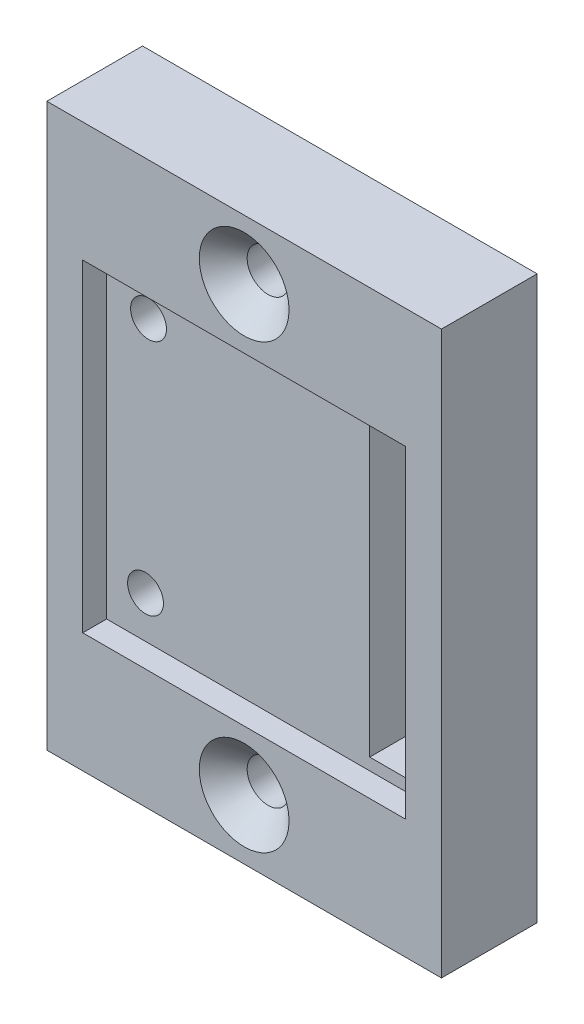
from build123d import *

# Parameters (mm, degrees)
SKETCH1_W           = 33
SKETCH1_H           = 47
SKETCH1_R           = 1.75
SKETCH1_W_2         = 27
SKETCH1_H_2         = 27
BOSS_EXTRUDE1_DEPTH = 8
SKETCH3_W           = 27
SKETCH3_H           = 27
BOSS_EXTRUDE2_DEPTH = 6
CHAMFER1_SIZE       = 2
SKETCH4_R           = 1.5
CUT_EXTRUDE1_DEPTH  = 10
SKETCH5_W           = 4
SKETCH5_H           = 25
CUT_EXTRUDE2_DEPTH  = 3
CUT_EXTRUDE3_DEPTH  = 3


with BuildPart() as part:
    # Sketch1 → Boss-Extrude1 (new body)
    with BuildSketch(Plane.XY):
        with Locations((16.5, 23.5)):
            Rectangle(SKETCH1_W, SKETCH1_H)
        with Locations((16.5, 42)):
            Circle(SKETCH1_R, mode=Mode.SUBTRACT)
        with Locations((16.5, 5)):
            Circle(SKETCH1_R, mode=Mode.SUBTRACT)
        with Locations((16.5, 23.5)):
            Rectangle(SKETCH1_W_2, SKETCH1_H_2, mode=Mode.SUBTRACT)
    extrude(amount=BOSS_EXTRUDE1_DEPTH)

    # Sketch3 → Boss-Extrude2 (add)
    with BuildSketch(Plane(origin=(0, 0, 0), x_dir=(-1, 0, 0), z_dir=(0, 0, -1))):
        with Locations((-16.5, 23.5)):
            Rectangle(SKETCH3_W, SKETCH3_H)
    extrude(amount=-BOSS_EXTRUDE2_DEPTH)

    # Chamfer1
    chamfer1_edges = [part.edges().sort_by_distance(p)[0] for p in [
        (14.75, 42, 8),
        (14.75, 5, 8),
    ]]
    chamfer(chamfer1_edges, length=CHAMFER1_SIZE)

    # Sketch4 → Cut-Extrude1 (cut)
    with BuildSketch(Plane.XY.offset(6)):
        with Locations((6.5, 33.5)):
            Circle(SKETCH4_R)
        with Locations((6.25, 13.501562561)):
            Circle(SKETCH4_R)
    extrude(amount=-CUT_EXTRUDE1_DEPTH, mode=Mode.SUBTRACT)

    # Sketch5 → Cut-Extrude2 (cut)
    with BuildSketch(Plane.XY.offset(6)):
        with Locations((27, 23.5)):
            Rectangle(SKETCH5_W, SKETCH5_H)
    extrude(amount=-CUT_EXTRUDE2_DEPTH, mode=Mode.SUBTRACT)

    # Sketch6 → Cut-Extrude3 (cut)
    with BuildSketch(Plane(origin=(0, 0, 0), x_dir=(-1, 0, 0), z_dir=(0, 0, -1))):
        Polygon((-6.5, 36.964101615), (-9.5, 35.232050808), (-9.5, 31.767949192), (-6.5, 30.035898385), (-3.5, 31.767949192), (-3.5, 35.232050808), align=None)
        Polygon((-3.25, 15.233613369), (-6.25, 16.965664176), (-9.25, 15.233613369), (-9.25, 11.769511753), (-6.25, 10.037460946), (-3.25, 11.769511753), align=None)
    extrude(amount=-CUT_EXTRUDE3_DEPTH, mode=Mode.SUBTRACT)


solid = part.part
